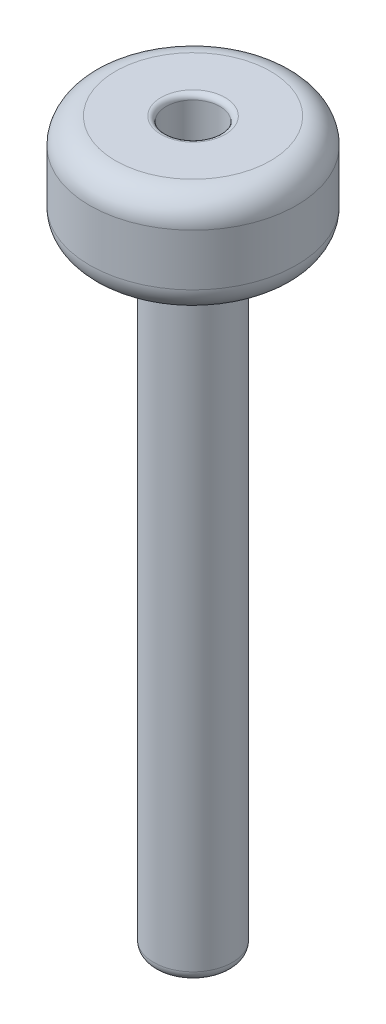
from build123d import *

# Parameters (mm, degrees)
SKETCH_1_R          = 7.6
SKETCH_1_R_2        = 5.2
EXTRUDE_1_DEPTH     = 120
SKETCH_2_R          = 20
EXTRUDE_2_DEPTH     = 20
CUT_EXTRUDE_START   = -157
SKETCH_3_R          = 5.2
CUT_EXTRUDE_1_DEPTH = 157
FILLET_1_R          = 5
FILLET_2_R          = 2
FILLET_3_R          = 1


with BuildPart() as part:
    # 草图1 → 凸台-拉伸1 (new body)
    with BuildSketch(Plane(origin=(0, 0, 0), x_dir=(1, 0, 0), z_dir=(0, 1, 0))):
        with Locations(Location((0, 0, 0), (0, 0, 270))):
            Circle(SKETCH_1_R)
        with Locations(Location((0, 0, 0), (0, 0, 270))):
            Circle(SKETCH_1_R_2, mode=Mode.SUBTRACT)
    extrude(amount=EXTRUDE_1_DEPTH)

    # 草图2 → 凸台-拉伸2 (add)
    with BuildSketch(Plane(origin=(0, 120, 0), x_dir=(1, 0, 0), z_dir=(0, 1, 0))):
        with Locations(Location((0, 0, 0), (0, 0, 270))):
            Circle(SKETCH_2_R)
    extrude(amount=EXTRUDE_2_DEPTH)

    # 草图3 → 切除-拉伸1 (cut)
    with BuildSketch(Plane(origin=(0, 140, 0), x_dir=(1, 0, 0), z_dir=(0, 1, 0)).offset(CUT_EXTRUDE_START)):
        with Locations(Location((0, 0, 0), (0, 0, 270))):
            Circle(SKETCH_3_R)
    extrude(amount=CUT_EXTRUDE_1_DEPTH, mode=Mode.SUBTRACT)

    # 圆角1
    fillet_1_edges = [part.edges().sort_by_distance(p)[0] for p in [
        (0, 140, -20),
        (0, 120, -20),
    ]]
    fillet(fillet_1_edges, radius=FILLET_1_R)

    # 圆角2
    fillet_2_edges = [part.edges().sort_by_distance(p)[0] for p in [
        (0, 0, -7.6),
        (0, 120, -7.6),
    ]]
    fillet(fillet_2_edges, radius=FILLET_2_R)

    # 圆角3
    fillet_3_edges = [part.edges().sort_by_distance(p)[0] for p in [
        (0, 140, -5.2),
    ]]
    fillet(fillet_3_edges, radius=FILLET_3_R)


solid = part.part
